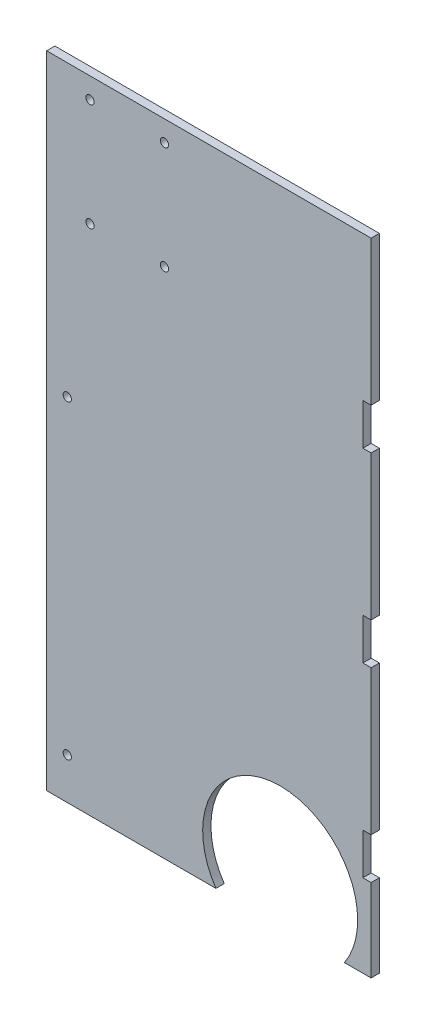
from build123d import *

# Parameters (mm, degrees)
SKETCH1_W           = 165
SKETCH1_H           = 330
BOSS_EXTRUDE1_DEPTH = 4
SKETCH2_R           = 37.5
CUT_EXTRUDE1_DEPTH  = 202.285866369
SKETCH4_W           = 8
SKETCH4_H           = 300
CUT_EXTRUDE3_DEPTH  = 202.285866369
SKETCH3_W           = 4
SKETCH3_H           = 20
CUT_EXTRUDE2_DEPTH  = 202.285866369
SKETCH5_W           = 8
SKETCH5_H           = 30
CUT_EXTRUDE4_DEPTH  = 202.285866369
SKETCH6_R           = 2
CUT_EXTRUDE5_DEPTH  = 198.838317825
SKETCH7_R           = 2
CUT_EXTRUDE6_DEPTH  = 198.838317825
SKETCH8_W           = 153
SKETCH8_H           = 20
CUT_EXTRUDE7_DEPTH  = 198.838317825


with BuildPart() as part:
    # Sketch1 → Boss-Extrude1 (new body)
    with BuildSketch(Plane.XY):
        with Locations((7.5, -15)):
            Rectangle(SKETCH1_W, SKETCH1_H)
    extrude(amount=BOSS_EXTRUDE1_DEPTH)

    # Sketch2 → Cut-Extrude1 (cut, through all)
    with BuildSketch(Plane.XY.offset(4)):
        with Locations((38, -159)):
            Circle(SKETCH2_R)
    extrude(amount=-CUT_EXTRUDE1_DEPTH, mode=Mode.SUBTRACT)

    # Sketch4 → Cut-Extrude3 (cut, through all)
    with BuildSketch(Plane(origin=(0, 0, 0), x_dir=(-1, 0, 0), z_dir=(0, 0, -1))):
        with Locations((-86, 0)):
            Rectangle(SKETCH4_W, SKETCH4_H)
    extrude(amount=-CUT_EXTRUDE3_DEPTH, mode=Mode.SUBTRACT)

    # Sketch3 → Cut-Extrude2 (cut, through all)
    with BuildSketch(Plane(origin=(0, 0, 0), x_dir=(-1, 0, 0), z_dir=(0, 0, -1))):
        with Locations((-80, 140)):
            Rectangle(SKETCH3_W, SKETCH3_H)
        with Locations((-80, 50)):
            Rectangle(SKETCH3_W, SKETCH3_H)
        with Locations((-80, -40)):
            Rectangle(SKETCH3_W, SKETCH3_H)
        with Locations((-80, -130)):
            Rectangle(SKETCH3_W, SKETCH3_H)
    extrude(amount=-CUT_EXTRUDE2_DEPTH, mode=Mode.SUBTRACT)

    # Sketch5 → Cut-Extrude4 (cut, through all)
    with BuildSketch(Plane.XY.offset(4)):
        with Locations((86, -165)):
            Rectangle(SKETCH5_W, SKETCH5_H)
    extrude(amount=-CUT_EXTRUDE4_DEPTH, mode=Mode.SUBTRACT)

    # Sketch6 → Cut-Extrude5 (cut, through all)
    with BuildSketch(Plane(origin=(0, 0, 0), x_dir=(-1, 0, 0), z_dir=(0, 0, -1))):
        with Locations((18, 120)):
            Circle(SKETCH6_R)
        with Locations((54, 120)):
            Circle(SKETCH6_R)
        with Locations((18, 68)):
            Circle(SKETCH6_R)
        with Locations((54, 68)):
            Circle(SKETCH6_R)
    extrude(amount=-CUT_EXTRUDE5_DEPTH, mode=Mode.SUBTRACT)

    # Sketch7 → Cut-Extrude6 (cut, through all)
    with BuildSketch(Plane.XY.offset(4)):
        with Locations((-65, 140)):
            Circle(SKETCH7_R)
        with Locations((-65, -10)):
            Circle(SKETCH7_R)
        with Locations((-65, -160)):
            Circle(SKETCH7_R)
    extrude(amount=-CUT_EXTRUDE6_DEPTH, mode=Mode.SUBTRACT)

    # Sketch8 → Cut-Extrude7 (cut, through all)
    with BuildSketch(Plane(origin=(0, 0, 0), x_dir=(-1, 0, 0), z_dir=(0, 0, -1))):
        with Locations((-1.5, 140)):
            Rectangle(SKETCH8_W, SKETCH8_H)
    extrude(amount=-CUT_EXTRUDE7_DEPTH, mode=Mode.SUBTRACT)


solid = part.part
